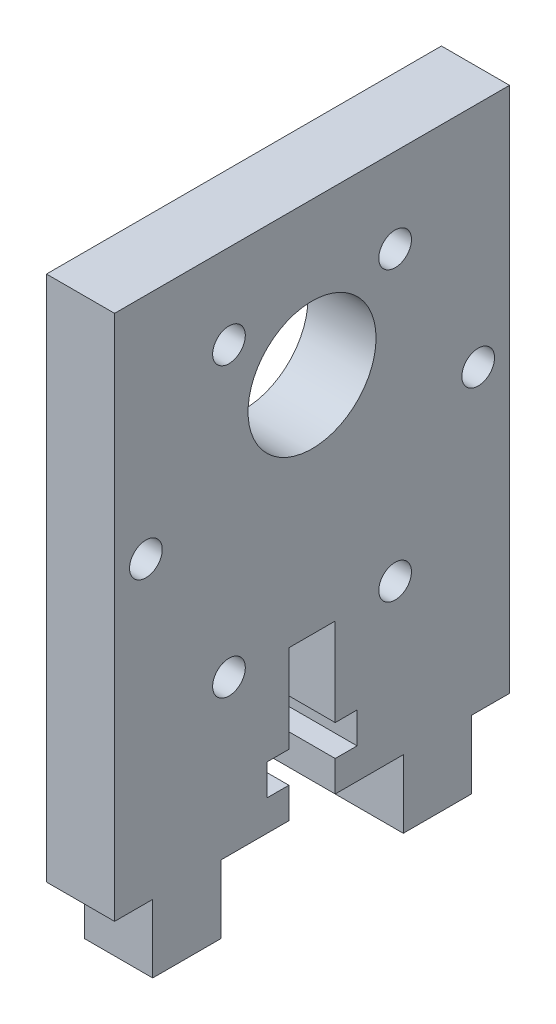
from build123d import *

# Parameters (mm, degrees)
MOTOR_PLATE_R       = 1.524
MOTOR_PLATE_R_2     = 5.969
BOSS_EXTRUDE1_DEPTH = 6.35


with BuildPart() as part:
    # Motor plate → Boss-Extrude1 (new body)
    with BuildSketch(Plane(origin=(0, 0, 0), x_dir=(0, 0, -1), z_dir=(1, 0, 0))):
        Polygon((-18.415, -24.552598803), (-14.859, -24.552598803), (-14.859, -30.902598803), (-8.509, -30.902598803), (-8.509, -24.552598803), (-2.159, -24.552598803), (-2.159, -21.684895821), (-4.199999982, -21.684895821), (-4.199999982, -18.784895779), (-2.159, -18.784895779), (-2.159, -10.582598803), (2.159, -10.582598803), (2.159, -18.784895779), (4.199999982, -18.784895779), (4.199999982, -21.684895821), (2.159, -21.684895821), (2.159, -24.552598803), (8.509, -24.552598803), (8.509, -30.902598803), (14.859, -30.902598803), (14.859, -24.552598803), (18.415, -24.552598803), (18.415, 24.552598803), (-18.415, 24.552598803), align=None)
        with Locations((7.747, 16.678598803)):
            Circle(MOTOR_PLATE_R, mode=Mode.SUBTRACT)
        with Locations((15.494, 3.260401197)):
            Circle(MOTOR_PLATE_R, mode=Mode.SUBTRACT)
        with Locations((7.747, -10.157796409)):
            Circle(MOTOR_PLATE_R, mode=Mode.SUBTRACT)
        with Locations((-7.747, -10.157796409)):
            Circle(MOTOR_PLATE_R, mode=Mode.SUBTRACT)
        with Locations((-15.494, 3.260401197)):
            Circle(MOTOR_PLATE_R, mode=Mode.SUBTRACT)
        with Locations((-7.747, 16.678598803)):
            Circle(MOTOR_PLATE_R, mode=Mode.SUBTRACT)
        with Locations((0, 10.372401197)):
            Circle(MOTOR_PLATE_R_2, mode=Mode.SUBTRACT)
    extrude(amount=BOSS_EXTRUDE1_DEPTH)


solid = part.part
